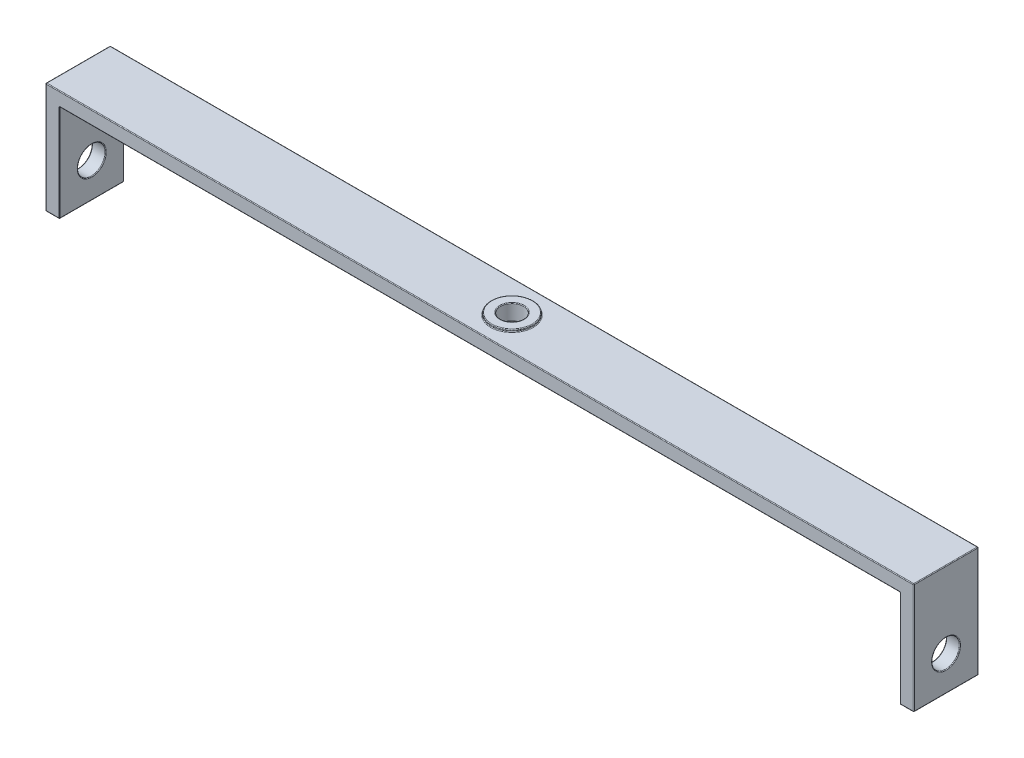
from build123d import *

# Parameters (mm, degrees)
BOSS_EXTRUDE1_DEPTH     = 3.5
SKETCH2_R               = 1.25
CUT_EXTRUDE1_DEPTH      = 49.633835958
SKETCH3_R               = 2.25
SKETCH3_R_2             = 1.25
BOSS_EXTRUDE2_DEPTH     = 0.25
CUT_EXTRUDE2_DEPTH      = 49.633835958
CUT_EXTRUDE2_DEPTH_BACK = 49.633835958
SKETCH4_R               = 1.5
FILLET1_R               = 0.075


with BuildPart() as part:
    # Sketch1 → Boss-Extrude1 (new, symmetric)
    with BuildSketch(Plane.XY):
        Polygon((-47, -12), (-47, 0), (47, 0), (47, -12), (45.5, -12), (45.5, -1.5), (-45.5, -1.5), (-45.5, -12), align=None)
    extrude(amount=BOSS_EXTRUDE1_DEPTH, both=True)

    # Sketch2 → Cut-Extrude1 (cut, through all)
    with BuildSketch(Plane(origin=(0, 0, 0), x_dir=(1, 0, 0), z_dir=(0, 1, 0))):
        with Locations(Location((0, 0, 0), (0, 0, 180))):
            Circle(SKETCH2_R)
    extrude(amount=-CUT_EXTRUDE1_DEPTH, mode=Mode.SUBTRACT)

    # Sketch3 → Boss-Extrude2 (add, symmetric)
    with BuildSketch(Plane(origin=(0, 0, 0), x_dir=(1, 0, 0), z_dir=(0, 1, 0))):
        Circle(SKETCH3_R)
        with Locations(Location((0, 0, 0), (0, 0, 180))):
            Circle(SKETCH3_R_2, mode=Mode.SUBTRACT)
    extrude(amount=BOSS_EXTRUDE2_DEPTH, both=True)

    # Sketch4 → Cut-Extrude2 (cut, two sides: drawn at the far end of the back side and taken through both)
    with BuildSketch(Plane(origin=(0, 0, 0), x_dir=(0, 0, -1), z_dir=(1, 0, 0)).offset(-CUT_EXTRUDE2_DEPTH_BACK)):
        with Locations((0, -8.25)):
            Circle(SKETCH4_R)
    extrude(amount=CUT_EXTRUDE2_DEPTH + CUT_EXTRUDE2_DEPTH_BACK, mode=Mode.SUBTRACT)

    # Fillet1
    fillet1_edges = [part.edges().sort_by_distance(p)[0] for p in [
        (45.5, -6.75, -3.5),
        (0, -1.5, -3.5),
        (-45.5, -6.75, -3.5),
        (-46.25, -12, -3.5),
        (0, -1.5, 3.5),
        (-47, -12, 0),
        (-47, 0, 0),
        (47, 0, 0),
        (47, -12, 0),
        (45.5, -12, 0),
        (45.5, -1.5, 0),
        (-45.5, -1.5, 0),
        (-45.5, -12, 0),
        (45.5, -6.75, 3.5),
        (46.25, -12, 3.5),
        (47, -6, 3.5),
        (1.25, -1.5, 0),
        (0, 0, 3.5),
        (-2.25, 0, 0),
        (1.25, 0.25, 0),
        (-2.25, 0.25, 0),
        (-47, -6, 3.5),
        (-47, -8.25, 1.5),
        (-45.5, -8.25, 1.5),
        (45.5, -8.25, 1.5),
        (47, -8.25, 1.5),
        (-46.25, -12, 3.5),
        (-47, -6, -3.5),
        (-45.5, -6.75, 3.5),
        (0, 0, -3.5),
        (47, -6, -3.5),
        (46.25, -12, -3.5),
    ]]
    fillet(fillet1_edges, radius=FILLET1_R)


solid = part.part
